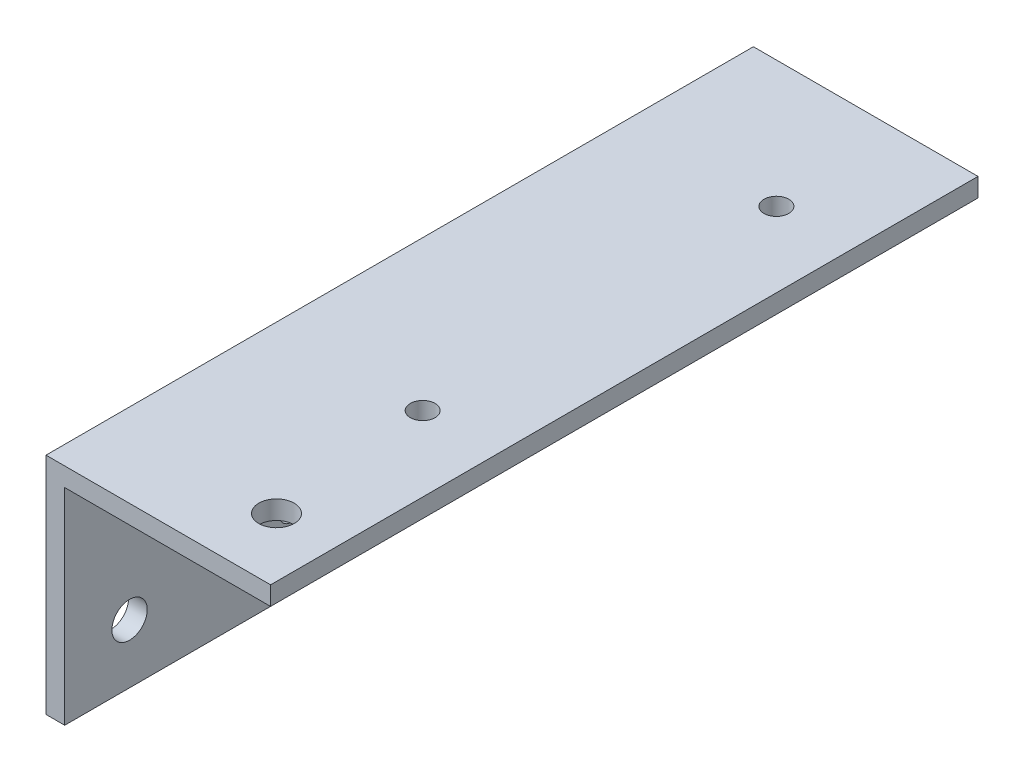
from build123d import *

# Parameters (mm, degrees)
SKETCH1_W                      = 38.1
SKETCH1_H                      = 120
BOSS_EXTRUDE1_DEPTH            = 38.1
SKETCH2_W                      = 34.925
SKETCH2_H                      = 34.925
CUT_EXTRUDE1_DEPTH             = 130.767142413
F_4_2_4_2_DIAMETER_HOLE1_D     = 4.2
F_6_0_6_DIAMETER_HOLE1_D       = 6
F_4_2_4_2_DIAMETER_HOLE2_D     = 4.2
F_4_2_4_2_DIAMETER_HOLE2_DEPTH = 38.1
F_6_0_6_DIAMETER_HOLE2_D       = 6
F_6_0_6_DIAMETER_HOLE2_DEPTH   = 38.1
F_6_0_6_DIAMETER_HOLE3_D       = 6
F_6_0_6_DIAMETER_HOLE3_DEPTH   = 38.1
F_4_2_4_2_DIAMETER_HOLE3_D     = 4.2
SKETCH15_R                     = 2.1
SKETCH15_R_2                   = 3
BOSS_EXTRUDE2_DEPTH            = 3.175
BOSS_EXTRUDE3_START            = -3.175
SKETCH16_R                     = 3
SKETCH16_R_2                   = 2.1
BOSS_EXTRUDE3_DEPTH            = 3.175


with BuildPart() as part:
    # Sketch1 → Boss-Extrude1 (new body)
    with BuildSketch(Plane.XZ.offset(34.925)):
        with Locations((15.875, -55)):
            Rectangle(SKETCH1_W, SKETCH1_H)
    extrude(amount=-BOSS_EXTRUDE1_DEPTH)

    # Sketch2 → Cut-Extrude1 (cut, through all)
    with BuildSketch(Plane(origin=(0, 0, -115), x_dir=(-1, 0, 0), z_dir=(0, 0, -1))):
        with Locations((-17.4625, -17.4625)):
            Rectangle(SKETCH2_W, SKETCH2_H)
    extrude(amount=-CUT_EXTRUDE1_DEPTH, mode=Mode.SUBTRACT)

    # Ø4.2 (4.2) Diameter Hole1 (through all)
    with Locations(Plane(origin=(0, 0, 0), x_dir=(-1, 0, 0), z_dir=(0, -1, 0))):
        with Locations((-5, 35.97), (-5, 91.03)):
            Hole(F_4_2_4_2_DIAMETER_HOLE1_D / 2)

    # Ø6.0 (6) Diameter Hole1 (through all)
    with Locations(Plane(origin=(0, 0, 0), x_dir=(-1, 0, 0), z_dir=(0, -1, 0))):
        with Locations((-22.225, 106.5), (-22.225, 46.5)):
            Hole(F_6_0_6_DIAMETER_HOLE1_D / 2)

    # Ø4.2 (4.2) Diameter Hole2
    with Locations(Plane(origin=(0, 3.175, 0), x_dir=(1, 0, 0), z_dir=(0, 1, 0))):
        with Locations((22.225, 33.5), (22.225, 93.5), (29.296067812, 100.571067812), (29.296067812, 26.428932188)):
            Hole(F_4_2_4_2_DIAMETER_HOLE2_D / 2, depth=F_4_2_4_2_DIAMETER_HOLE2_DEPTH)

    # Ø6.0 (6) Diameter Hole2
    with Locations(Plane(origin=(0, 3.175, 0), x_dir=(1, 0, 0), z_dir=(0, 1, 0))):
        with Locations((24.925, 6)):
            Hole(F_6_0_6_DIAMETER_HOLE2_D / 2, depth=F_6_0_6_DIAMETER_HOLE2_DEPTH)

    # Ø6.0 (6) Diameter Hole3
    with Locations(Plane.ZY.offset(3.175)):
        with Locations((-6, -24.925), (-106.5, -22.225), (-46.5, -22.225)):
            Hole(F_6_0_6_DIAMETER_HOLE3_D / 2, depth=F_6_0_6_DIAMETER_HOLE3_DEPTH)

    # Ø4.2 (4.2) Diameter Hole3 (through all)
    with Locations(Plane.ZY.offset(3.175)):
        with Locations((-93.5, -22.225), (-33.5, -22.225), (-35.97, -5), (-91.03, -5), (-100.571067812, -29.296067812), (-26.428932188, -29.296067812)):
            Hole(F_4_2_4_2_DIAMETER_HOLE3_D / 2)

    # Sketch15 → Boss-Extrude2 (add)
    with BuildSketch(Plane(origin=(0, 3.175, 0), x_dir=(1, 0, 0), z_dir=(0, 1, 0))):
        with Locations((29.296067812, 26.428932188)):
            Circle(SKETCH15_R)
        with Locations((29.296067812, 100.571067812)):
            Circle(SKETCH15_R)
        with Locations((22.225, 106.5)):
            Circle(SKETCH15_R_2)
        with Locations((22.225, 46.5)):
            Circle(SKETCH15_R_2)
        with Locations((5, 35.97)):
            Circle(SKETCH15_R)
        with Locations((5, 91.03)):
            Circle(SKETCH15_R)
    extrude(amount=-BOSS_EXTRUDE2_DEPTH)

    # Sketch16 → Boss-Extrude3 (add)
    with BuildSketch(Plane.ZY.offset(3.175).offset(BOSS_EXTRUDE3_START)):
        with Locations((-106.5, -22.225)):
            Circle(SKETCH16_R)
        with Locations((-100.571067812, -29.296067812)):
            Circle(SKETCH16_R_2)
        with Locations((-46.5, -22.225)):
            Circle(SKETCH16_R)
        with Locations((-26.428932188, -29.296067812)):
            Circle(SKETCH16_R_2)
        with Locations((-35.97, -5)):
            Circle(SKETCH16_R_2)
        with Locations((-91.03, -5)):
            Circle(SKETCH16_R_2)
    extrude(amount=BOSS_EXTRUDE3_DEPTH)


solid = part.part
